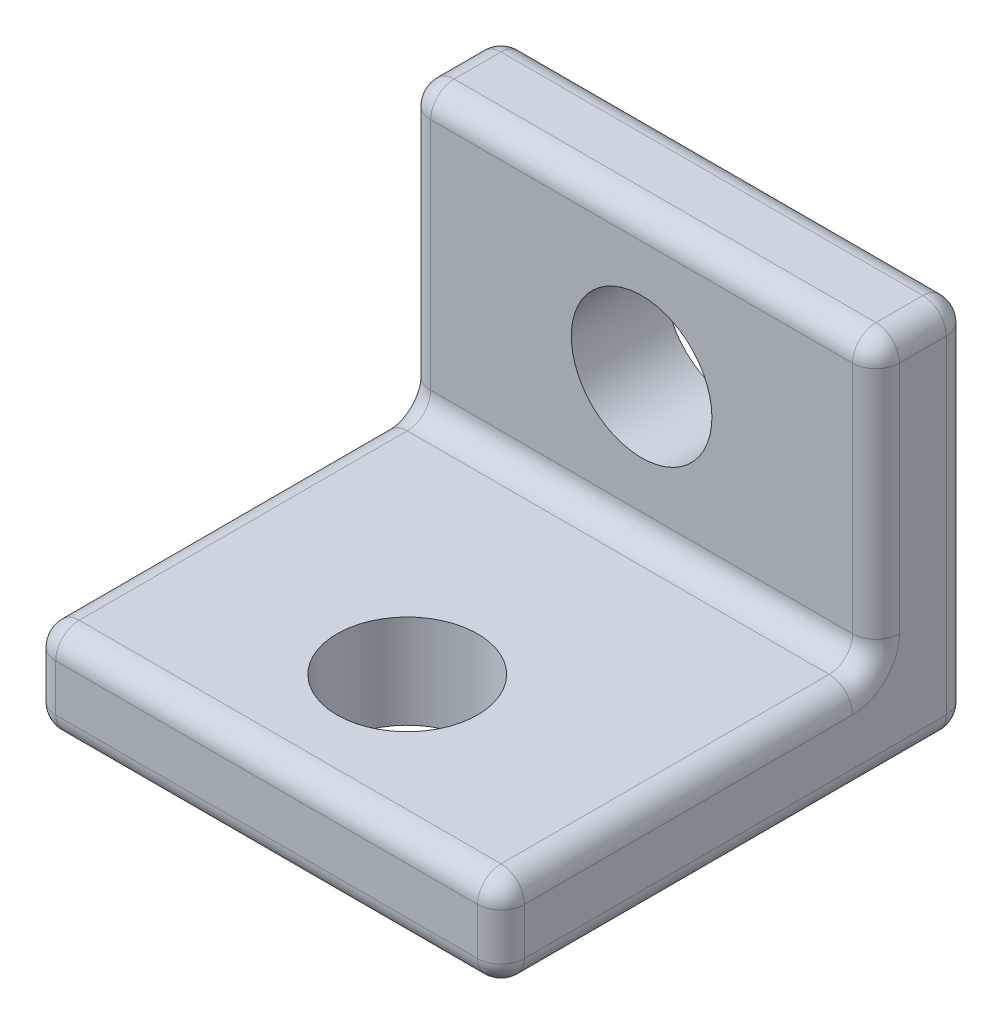
from build123d import *

# Parameters (mm, degrees)
SKETCH1_W           = 10
SKETCH1_H           = 8
BOSS_EXTRUDE1_DEPTH = 2
SKETCH2_W           = 10
SKETCH2_H           = 2
BOSS_EXTRUDE2_DEPTH = 8
SKETCH3_R           = 1.5
CUT_EXTRUDE1_DEPTH  = 10.848857802
SKETCH4_R           = 1.5
CUT_EXTRUDE2_DEPTH  = 13.369316877
FILLET1_R           = 0.5


with BuildPart() as part:
    # Sketch1 → Boss-Extrude1 (new body)
    with BuildSketch(Plane(origin=(0, 0, 0), x_dir=(1, 0, 0), z_dir=(0, 1, 0))):
        Rectangle(SKETCH1_W, SKETCH1_H)
    extrude(amount=BOSS_EXTRUDE1_DEPTH)

    # Sketch2 → Boss-Extrude2 (add)
    with BuildSketch(Plane(origin=(0, 0, 0), x_dir=(1, 0, 0), z_dir=(0, 1, 0))):
        with Locations((0, 5)):
            Rectangle(SKETCH2_W, SKETCH2_H)
    extrude(amount=BOSS_EXTRUDE2_DEPTH)

    # Sketch3 → Cut-Extrude1 (cut, through all)
    with BuildSketch(Plane(origin=(0, 2, 0), x_dir=(1, 0, 0), z_dir=(0, 1, 0))):
        with Locations(Location((0, -1, 0), (0, 0, 270))):
            Circle(SKETCH3_R)
    extrude(amount=-CUT_EXTRUDE1_DEPTH, mode=Mode.SUBTRACT)

    # Sketch4 → Cut-Extrude2 (cut, through all)
    with BuildSketch(Plane.XY.offset(-4)):
        with Locations((0, 5)):
            Circle(SKETCH4_R)
    extrude(amount=-CUT_EXTRUDE2_DEPTH, mode=Mode.SUBTRACT)

    # Fillet1
    fillet1_edges = [part.edges().sort_by_distance(p)[0] for p in [
        (-5, 2, 0),
        (5, 5, -4),
        (0, 0, -6),
        (5, 4, -6),
        (-5, 4, -6),
        (-5, 5, -4),
        (5, 8, -5),
        (0, 8, -6),
        (0, 2, 4),
        (-5, 8, -5),
        (0, 8, -4),
        (5, 2, 0),
        (0, 0, 4),
        (-5, 0, -1),
        (5, 0, -1),
        (5, 1, 4),
        (-5, 1, 4),
        (0, 2, -4),
    ]]
    fillet(fillet1_edges, radius=FILLET1_R)


solid = part.part
